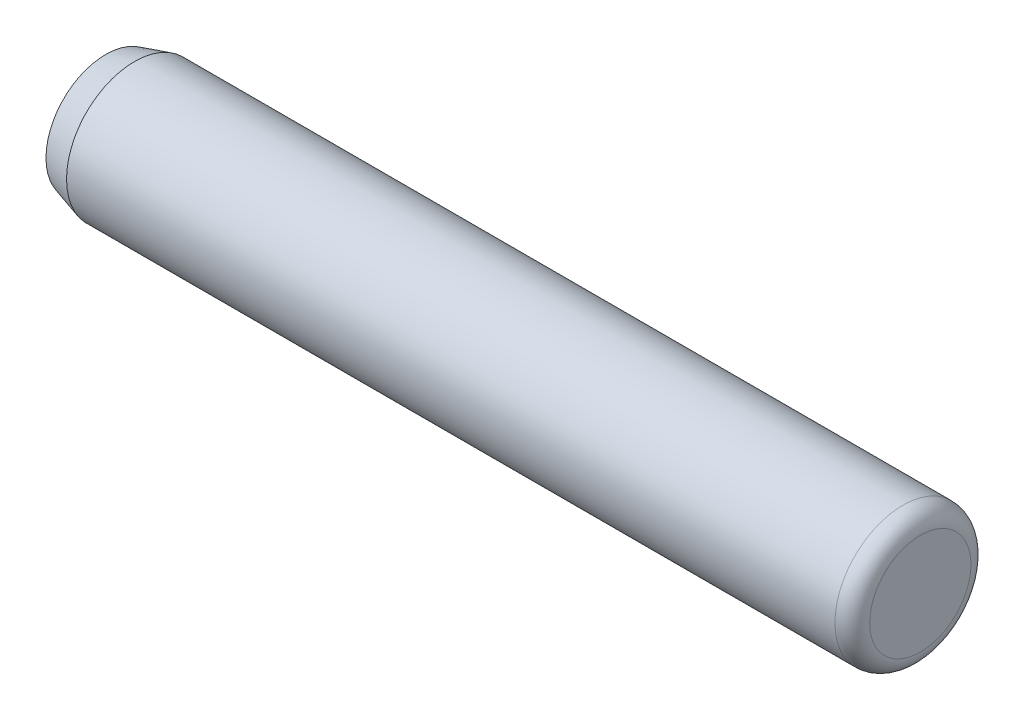
from build123d import *


with BuildPart() as part:
    # Sketch3 → Revolve1 (revolve)
    with BuildSketch(Plane.XY, mode=Mode.PRIVATE) as revolve1_sk:
        with BuildLine():
            Line((9.525, 1.18364), (9.525, 0))
            Line((9.525, 0), (-9.525, 0))
            Line((-9.525, 0), (-9.525, 1.397))
            Line((-9.525, 1.397), (-8.851789516, 1.59004))
            Line((-8.851789516, 1.59004), (9.1186, 1.59004))
            ThreePointArc((9.1186, 1.59004), (9.405968196, 1.471008196), (9.525, 1.18364))
        make_face()
    revolve(revolve1_sk.sketch.rotate(Axis((-9.525, 0, 0), (1, 0, 0)), 90), axis=Axis((-9.525, 0, 0), (1, 0, 0)))


solid = part.part
